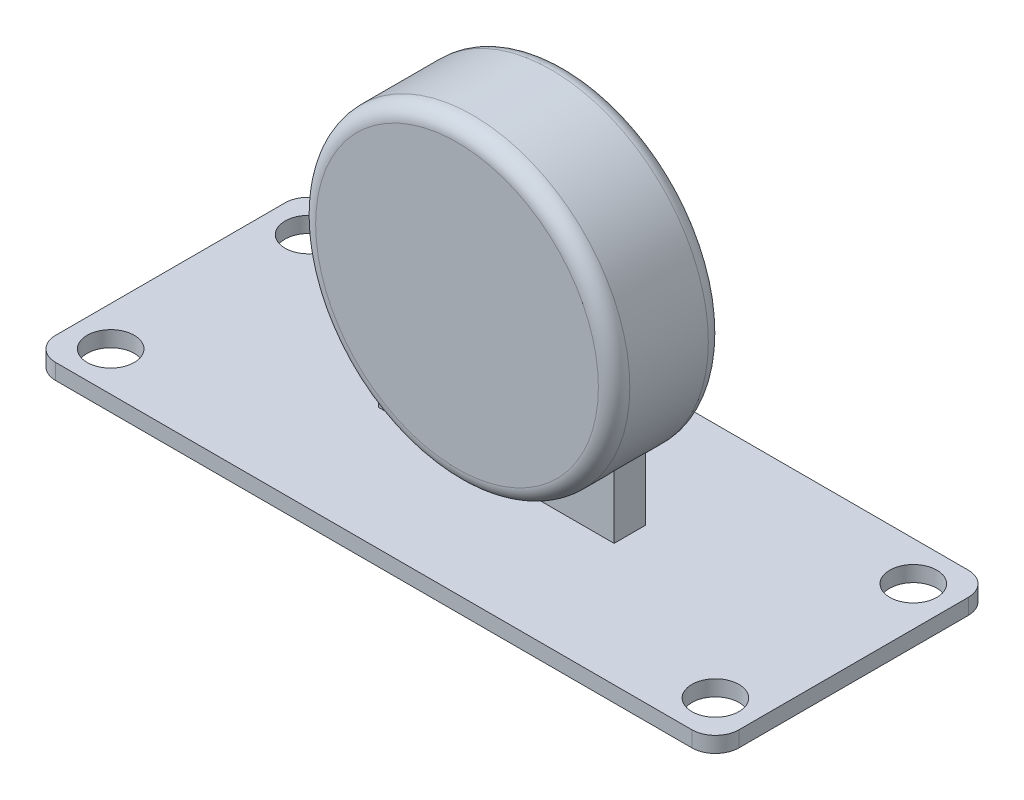
from build123d import *

# Parameters (mm, degrees)
SKETCH1_R                = 38.1
BOSS_EXTRUDE1_DEPTH      = 25.4
BOSS_EXTRUDE2_DEPTH      = 25.4
BOSS_EXTRUDE2_DEPTH_BACK = 25.4
BOSS_EXTRUDE3_DEPTH      = 88.9
BOSS_EXTRUDE3_DEPTH_BACK = 88.9
SKETCH4_R                = 254
FILLET1_R                = 25.4


with BuildPart() as part:
    # Sketch1 → Boss-Extrude1 (new body)
    with BuildSketch(Plane(origin=(0, 0, 0), x_dir=(1, 0, 0), z_dir=(0, 1, 0))):
        with BuildLine():
            Line((-514.35, 223.52), (514.35, 223.52))
            ThreePointArc((514.35, 223.52), (541.290768363, 212.360768363), (552.45, 185.42))
            Line((552.45, 185.42), (552.45, -185.42))
            ThreePointArc((552.45, -185.42), (541.290768363, -212.360768363), (514.35, -223.52))
            Line((514.35, -223.52), (-514.35, -223.52))
            ThreePointArc((-514.35, -223.52), (-541.290768363, -212.360768363), (-552.45, -185.42))
            Line((-552.45, -185.42), (-552.45, 185.42))
            ThreePointArc((-552.45, 185.42), (-541.290768363, 212.360768363), (-514.35, 223.52))
        make_face()
        with Locations(Location((-488.95, 160.02, 0), (0, 0, 270))):
            Circle(SKETCH1_R, mode=Mode.SUBTRACT)
        with Locations(Location((488.95, 160.02, 0), (0, 0, 270))):
            Circle(SKETCH1_R, mode=Mode.SUBTRACT)
        with Locations(Location((488.95, -160.02, 0), (0, 0, 270))):
            Circle(SKETCH1_R, mode=Mode.SUBTRACT)
        with Locations(Location((-488.95, -160.02, 0), (0, 0, 270))):
            Circle(SKETCH1_R, mode=Mode.SUBTRACT)
    extrude(amount=BOSS_EXTRUDE1_DEPTH)

    # Sketch3 → Boss-Extrude2 (add, two sides: drawn at the far end of the back side and taken through both)
    with BuildSketch(Plane.XY.offset(-BOSS_EXTRUDE2_DEPTH_BACK)):
        with BuildLine():
            Line((-190.5, 25.4), (190.5, 25.4))
            Line((190.5, 25.4), (190.5, 127))
            ThreePointArc((190.5, 127), (0, 41.005208253), (-190.5, 127))
            Line((-190.5, 127), (-190.5, 25.4))
        make_face()
    extrude(amount=BOSS_EXTRUDE2_DEPTH + BOSS_EXTRUDE2_DEPTH_BACK)

    # Sketch4 → Boss-Extrude3 (add, two sides: drawn at the far end of the back side and taken through both)
    with BuildSketch(Plane.XY.offset(-BOSS_EXTRUDE3_DEPTH_BACK)):
        with Locations((0, 295.005208253)):
            Circle(SKETCH4_R)
    extrude(amount=BOSS_EXTRUDE3_DEPTH + BOSS_EXTRUDE3_DEPTH_BACK)

    # Fillet1
    fillet1_edges = [part.edges().sort_by_distance(p)[0] for p in [
        (-254, 295.005208253, -88.9),
        (-254, 295.005208253, 88.9),
    ]]
    fillet(fillet1_edges, radius=FILLET1_R)


solid = part.part
